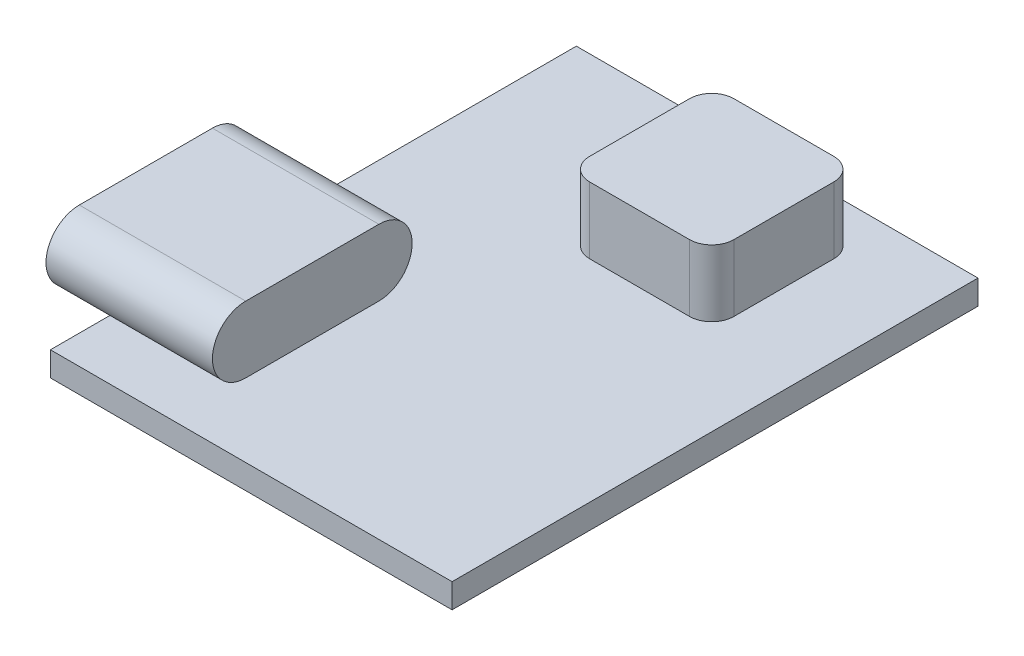
from build123d import *

# Parameters (mm, degrees)
SKETCH1_W                = 18.1
SKETCH1_H                = 23.7
BOSS_EXTRUDE1_DEPTH      = 1.1
BOSS_EXTRUDE2_DEPTH      = 2
BOSS_EXTRUDE2_DEPTH_BACK = 5.5
SHELL1_T                 = -0.3
SKETCH4_W                = 6.5
SKETCH4_H                = 6.5
BOSS_EXTRUDE3_DEPTH      = 3
FILLET1_R                = 1


with BuildPart() as part:
    # Sketch1 → Boss-Extrude1 (new body)
    with BuildSketch(Plane(origin=(0, 0, 0), x_dir=(1, 0, 0), z_dir=(0, 1, 0))):
        Rectangle(SKETCH1_W, SKETCH1_H)
    extrude(amount=BOSS_EXTRUDE1_DEPTH)


with BuildPart() as body_2:
    # Sketch3 → Boss-Extrude2 (new, two sides: drawn at the far end of the back side and taken through both)
    with BuildSketch(Plane.ZY.offset(9.05).offset(-BOSS_EXTRUDE2_DEPTH_BACK)):
        with BuildLine():
            Line((2.55, 4.1), (8.55, 4.1))
            ThreePointArc((8.55, 4.1), (10.05, 2.6), (8.55, 1.1))
            Line((8.55, 1.1), (2.55, 1.1))
            ThreePointArc((2.55, 1.1), (1.05, 2.6), (2.55, 4.1))
        make_face()
    extrude(amount=BOSS_EXTRUDE2_DEPTH + BOSS_EXTRUDE2_DEPTH_BACK)

    # Shell1
    shell1_openings = [body_2.faces().sort_by_distance(p)[0] for p in [
        (-11.05, 2.6, 5.55),
    ]]
    offset(amount=SHELL1_T, openings=shell1_openings, kind=Kind.INTERSECTION)


with BuildPart() as body_3:
    # Sketch4 → Boss-Extrude3 (new body)
    with BuildSketch(Plane(origin=(0, 1.1, 0), x_dir=(1, 0, 0), z_dir=(0, 1, 0))):
        with Locations((1.8, 7.1)):
            Rectangle(SKETCH4_W, SKETCH4_H)
    extrude(amount=BOSS_EXTRUDE3_DEPTH)

    # Fillet1
    fillet1_edges = [body_3.edges().sort_by_distance(p)[0] for p in [
        (-1.45, 2.6, -10.35),
        (5.05, 2.6, -10.35),
        (5.05, 2.6, -3.85),
        (-1.45, 2.6, -3.85),
    ]]
    fillet(fillet1_edges, radius=FILLET1_R)


solid = Compound([part.part, body_2.part, body_3.part])
